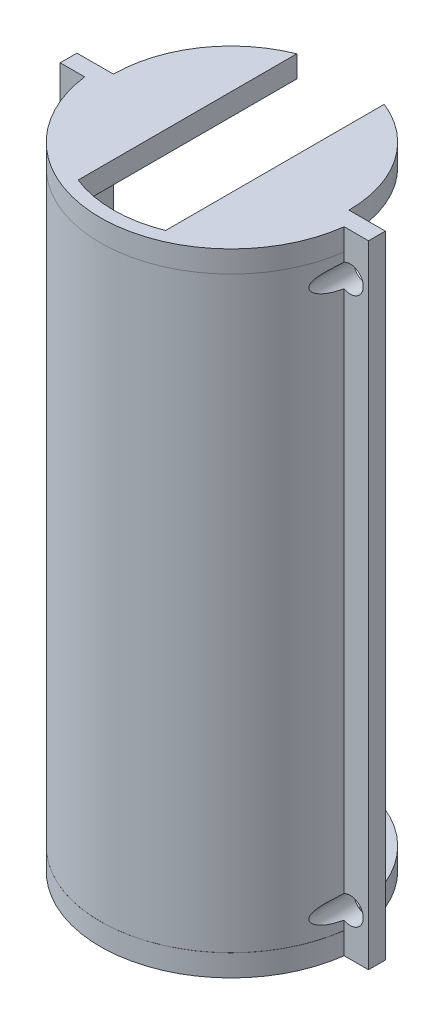
from build123d import *

# Parameters (mm, degrees)
BOSS_EXTRUDE3_DEPTH   = 72.39
BOSS_EXTRUDE5_DEPTH   = 2.5
BOSS_EXTRUDE6_START   = 69.89
BOSS_EXTRUDE6_DEPTH   = 2.5
F_3_0MM_DOWEL_HOLE2_D = 3
F_3_0MM_DOWEL_HOLE3_D = 3


with BuildPart() as part:
    # Sketch1 → Boss-Extrude3 (new body)
    with BuildSketch(Plane(origin=(0, 0, 0), x_dir=(1, 0, 0), z_dir=(0, 1, 0))):
        with BuildLine():
            Line((13.491537447, 0), (17.666973025, 0))
            Line((17.666973025, 0), (17.666973025, -1.92406576))
            Line((17.666973025, -1.92406576), (14.860010366, -1.92406576))
            ThreePointArc((14.860010366, -1.92406576), (-0.00846255, -14.992448629), (-14.876935466, -1.92406576))
            Line((-14.876935466, -1.92406576), (-17.683026975, -1.92406576))
            Line((-17.683026975, -1.92406576), (-17.683026975, 0))
            Line((-17.683026975, 0), (-13.508462552, 0))
            ThreePointArc((-13.508462552, 0), (-0.008462552, -13.5), (13.491537447, 0))
        make_face()
    extrude(amount=BOSS_EXTRUDE3_DEPTH)

    # Sketch8 → Boss-Extrude5 (add)
    with BuildSketch(Plane(origin=(0, 0, 0), x_dir=(1, 0, 0), z_dir=(0, 1, 0))):
        with BuildLine():
            Line((-13.5, 0), (-15, 0))
            ThreePointArc((-15, 0), (0, -15), (15, 0))
            Line((15, 0), (13.5, 0))
            ThreePointArc((13.5, 0), (11.178820599, 7.568617445), (5.013485922, 12.534550607))
            Line((5.013485922, 12.534550607), (5.013485922, -12.534550607))
            ThreePointArc((5.013485922, -12.534550607), (0, -13.5), (-5.013485922, -12.534550607))
            Line((-5.013485922, -12.534550607), (-5.013485922, 12.534550607))
            ThreePointArc((-5.013485922, 12.534550607), (-11.178820599, 7.568617445), (-13.5, 0))
        make_face()
    extrude(amount=BOSS_EXTRUDE5_DEPTH)

    # Sketch8<6> → Boss-Extrude6 (add)
    with BuildSketch(Plane(origin=(0, 0, 0), x_dir=(1, 0, 0), z_dir=(0, 1, 0)).offset(BOSS_EXTRUDE6_START)):
        with BuildLine():
            Line((-13.5, 0), (-15, 0))
            ThreePointArc((-15, 0), (0, -15), (15, 0))
            Line((15, 0), (13.5, 0))
            ThreePointArc((13.5, 0), (11.178820599, 7.568617445), (5.013485922, 12.534550607))
            Line((5.013485922, 12.534550607), (5.013485922, -12.534550607))
            ThreePointArc((5.013485922, -12.534550607), (0, -13.5), (-5.013485922, -12.534550607))
            Line((-5.013485922, -12.534550607), (-5.013485922, 12.534550607))
            ThreePointArc((-5.013485922, 12.534550607), (-11.178820599, 7.568617445), (-13.5, 0))
        make_face()
    extrude(amount=BOSS_EXTRUDE6_DEPTH)

    # Ø3.0mm Dowel Hole2 (through all)
    with Locations(Plane(origin=(0, 0, 0), x_dir=(-1, 0, 0), z_dir=(0, 0, -1))):
        with Locations((15.583026975, 67.54)):
            Hole(F_3_0MM_DOWEL_HOLE2_D / 2)

    # Ø3.0mm Dowel Hole3 (through all)
    with Locations(Plane(origin=(0, 0, 0), x_dir=(-1, 0, 0), z_dir=(0, 0, -1))):
        with Locations((-15.566973025, 67.540028113), (-15.566973025, 4.85), (15.583026975, 4.85)):
            Hole(F_3_0MM_DOWEL_HOLE3_D / 2)


solid = part.part
